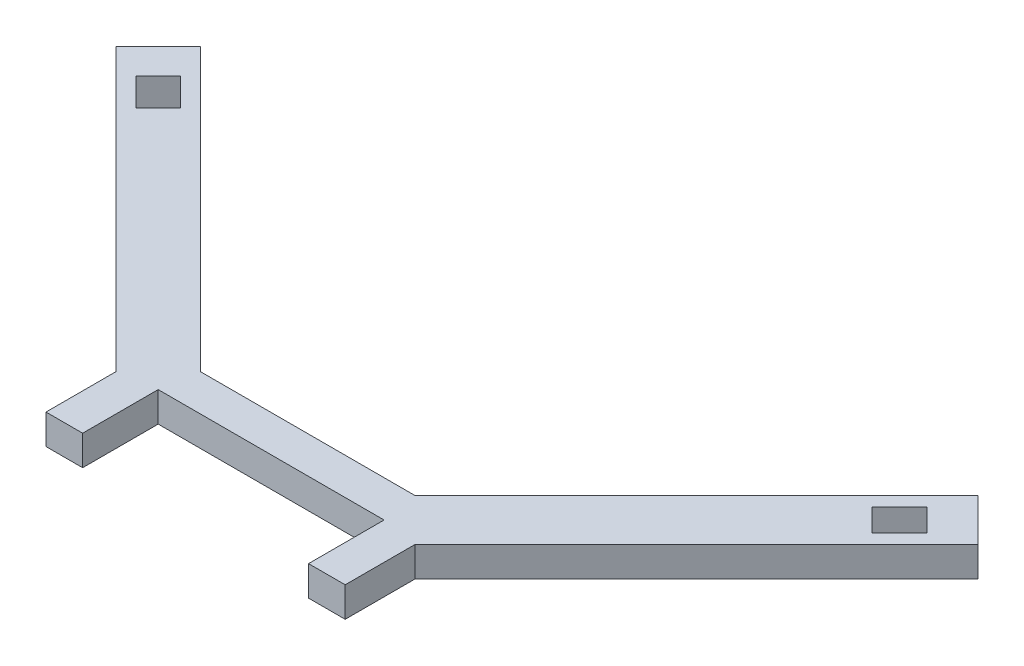
from build123d import *

# Parameters (mm, degrees)
EXTRUDE_1_DEPTH     = 8
CUT_EXTRUDE_1_DEPTH = 164.196200936
SKETCH_6_W          = 60.4
SKETCH_6_H          = 60.4
CUT_EXTRUDE_2_DEPTH = 164.196200936


with BuildPart() as part:
    # 草图2 → 凸台-拉伸1 (new body)
    with BuildSketch(Plane(origin=(0, 0, 0), x_dir=(1, 0, 0), z_dir=(0, 1, 0))):
        Polygon((-40, 28.686291501), (-40, 40), (-28.686291501, 40), (-103.944696834, 115.258405333), (-115.258405333, 103.944696834), align=None)
        Polygon((103.944696834, 115.258405333), (28.686291501, 40), (40, 40), (40, 28.686291501), (115.258405333, 103.944696834), align=None)
        Polygon((40, 10), (40, 40), (-40, 40), (-40, 10), (-30, 10), (-30, 30), (30, 30), (30, 10), align=None)
    extrude(amount=EXTRUDE_1_DEPTH)

    # 草图5 → 切除-拉伸1 (cut, through all)
    with BuildSketch(Plane(origin=(0, 8, 0), x_dir=(1, 0, 0), z_dir=(0, 1, 0))):
        Polygon((-105.783174466, 99.843477504), (-98.429263941, 92.489566979), (-92.489566979, 98.429263941), (-99.843477504, 105.783174466), align=None)
        Polygon((92.489566979, 98.429263941), (98.429263941, 92.489566979), (105.783174466, 99.843477504), (99.843477504, 105.783174466), align=None)
    extrude(amount=-CUT_EXTRUDE_1_DEPTH, mode=Mode.SUBTRACT)

    # 草图6 → 切除-拉伸2 (cut, through all)
    with BuildSketch(Plane(origin=(0, 8, 0), x_dir=(1, 0, 0), z_dir=(0, 1, 0))):
        Rectangle(SKETCH_6_W, SKETCH_6_H)
    extrude(amount=-CUT_EXTRUDE_2_DEPTH, mode=Mode.SUBTRACT)


solid = part.part
